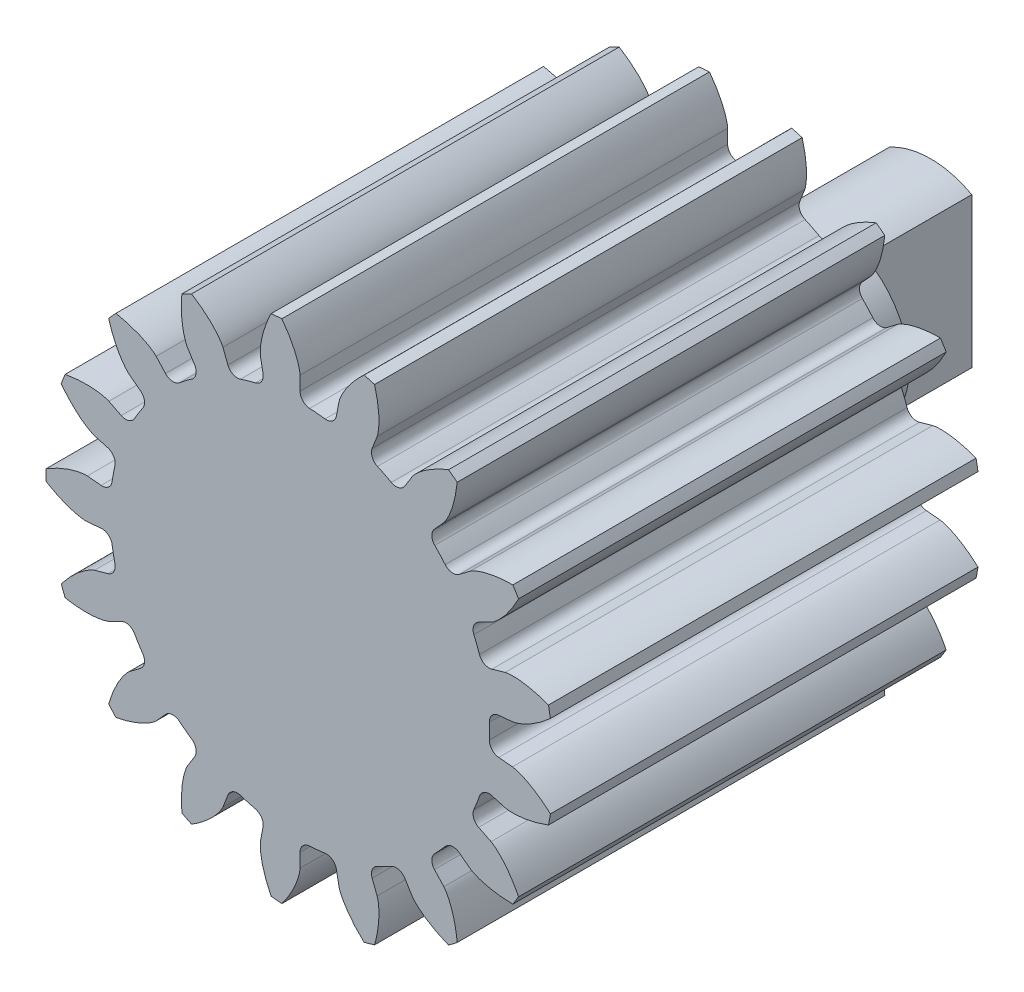
from build123d import *

# Parameters (mm, degrees)
BLANK_SKETCH_R           = 11.875
BLANK_DEPTH              = 20
TOOTH_SPACE_DEPTH        = 27.11572802
TEETH_COUNT              = 17
BORE_DEPTH               = 27.102125703
BORE_DEPTH_BACK          = 27.102125703
BORE_SKETCH_R            = 4
BOSS_EXTRUDE1_START      = -106
SKETCH1_R                = 4
BOSS_EXTRUDE1_DEPTH      = 106
BOSS_EXTRUDE2_DEPTH      = 27.5
BOSS_EXTRUDE2_DEPTH_BACK = 27.5
SKETCH2_R                = 4
CUT_EXTRUDE1_DEPTH       = 5


with BuildPart() as part:
    # Blank Sketch → Blank (new body)
    with BuildSketch(Plane.XY):
        Circle(BLANK_SKETCH_R)
    extrude(amount=BLANK_DEPTH)

    # Tooth Space Sketch → Tooth Space (cut, symmetric)
    with BuildSketch(Plane.XY):
        with BuildLine():
            Line((9.942364801, 0.91340716), (9.298767719, 0.854279759))
            ThreePointArc((9.298767719, 0.854279759), (8.984863997, 0.694192597), (8.867618155, 0.361902274))
            ThreePointArc((8.867618155, 0.361902274), (8.875, 0), (8.867618155, -0.361902274))
            ThreePointArc((8.867618155, -0.361902274), (8.984863997, -0.694192597), (9.298767719, -0.854279759))
            Line((9.298767719, -0.854279759), (9.942364801, -0.91340716))
            add(Edge.make_bspline(
                [(9.942364801, -0.91340716), (9.947707774, -0.913995463), (9.962658326, -0.915943937), (9.990773403, -0.92080477), (10.03637124, -0.930398576), (10.094010888, -0.945054989), (10.167889919, -0.966771469), (10.254035794, -0.995895766), (10.347670082, -1.031581288), (10.448308522, -1.074335805), (10.547535018, -1.120434221), (10.645345427, -1.169591339), (10.74167088, -1.221399901), (10.856958299, -1.28747082), (10.993207383, -1.371281114), (11.149344102, -1.475798759), (11.322581132, -1.601986981), (11.494732709, -1.73857283), (11.660412139, -1.879471881), (11.823262512, -2.029086969), (11.977584919, -2.17897923), (12.132897457, -2.341825663), (12.273746711, -2.495808162), (12.42574568, -2.675962445), (12.546739308, -2.823606943), (12.666700658, -2.982295404), (12.724336253, -3.060430467), (12.753472124, -3.10073762)],
                knots=[0, 0, 0, 0, 0, 0.005376748, 0.015083688, 0.02853182, 0.046610139, 0.064854849, 0.092110525, 0.119476176, 0.146842495, 0.174208854, 0.201574955, 0.228941013, 0.256307345, 0.307035032, 0.361767351, 0.41649966, 0.471231936, 0.525964282, 0.580696615, 0.635428982, 0.690161387, 0.744893688, 0.799626082, 0.854358408, 0.909090915, 0.909090915, 0.909090915, 0.909090915, 0.909090915], degree=4))
            Line((12.753472124, -3.10073762), (12.753472124, 3.10073762))
            add(Edge.make_bspline(
                [(9.942364801, 0.91340716), (9.947707774, 0.913995463), (9.962658326, 0.915943937), (9.990773403, 0.92080477), (10.03637124, 0.930398576), (10.094010888, 0.945054989), (10.167889919, 0.966771469), (10.254035794, 0.995895766), (10.347670082, 1.031581288), (10.448308522, 1.074335805), (10.547535018, 1.120434221), (10.645345427, 1.169591339), (10.74167088, 1.221399901), (10.856958299, 1.28747082), (10.993207383, 1.371281114), (11.149344102, 1.475798759), (11.322581132, 1.601986981), (11.494732709, 1.73857283), (11.660412139, 1.879471881), (11.823262512, 2.029086969), (11.977584919, 2.17897923), (12.132897457, 2.341825663), (12.273746711, 2.495808162), (12.42574568, 2.675962445), (12.546739308, 2.823606943), (12.666700658, 2.982295404), (12.724336253, 3.060430467), (12.753472124, 3.10073762)],
                knots=[0, 0, 0, 0, 0, 0.005376748, 0.015083688, 0.02853182, 0.046610139, 0.064854849, 0.092110525, 0.119476176, 0.146842495, 0.174208854, 0.201574955, 0.228941013, 0.256307345, 0.307035032, 0.361767351, 0.41649966, 0.471231936, 0.525964282, 0.580696615, 0.635428982, 0.690161387, 0.744893688, 0.799626082, 0.854358408, 0.909090915, 0.909090915, 0.909090915, 0.909090915, 0.909090915], degree=4))
        make_face()
    tooth_space = extrude(amount=TOOTH_SPACE_DEPTH, both=True, mode=Mode.SUBTRACT)

    # Teeth: Tooth Space ×17 about axis
    teeth_axis = Axis((0, 0, -95.500007), (0, 0, 1))
    for i in range(1, TEETH_COUNT):
        add(tooth_space.rotate(teeth_axis, i * 360 / TEETH_COUNT), mode=Mode.SUBTRACT)

    # Bore Sketch → Bore (cut, two sides: drawn at the far end of the back side and taken through both)
    with BuildSketch(Plane.XY.offset(-BORE_DEPTH_BACK)):
        Circle(BORE_SKETCH_R)
    extrude(amount=BORE_DEPTH + BORE_DEPTH_BACK, mode=Mode.SUBTRACT)

    # Sketch1 → Boss-Extrude1 (add)
    with BuildSketch(Plane.XY.offset(20).offset(BOSS_EXTRUDE1_START)):
        Circle(SKETCH1_R)
    extrude(amount=BOSS_EXTRUDE1_DEPTH)

    # Sketch2 → Boss-Extrude2 (add, two sides: drawn at the far end of the back side and taken through both)
    with BuildSketch(Plane(origin=(0, 0, 0), x_dir=(0, 0, -1), z_dir=(-0.25761039233351624, 0.9662488736147493, 0)).offset(-BOSS_EXTRUDE2_DEPTH_BACK)):
        with Locations(Location((86, 0, 0), (0, 0, 90))):
            Circle(SKETCH2_R)
    extrude(amount=BOSS_EXTRUDE2_DEPTH + BOSS_EXTRUDE2_DEPTH_BACK)

    # Split1
    split(bisect_by=Plane(origin=(0, 0, -9.5), x_dir=(-1, 0, 0), z_dir=(0, 0, -1)), keep=Keep.BOTTOM)

    # Sketch3 → Cut-Extrude1 (cut)
    with BuildSketch(Plane(origin=(0, 0, -9.5), x_dir=(-1, 0, 0), z_dir=(0, 0, -1))):
        with BuildLine():
            Line((-1.925, 3.506333555), (-1.925, -3.506333555))
            ThreePointArc((-1.925, -3.506333555), (-4, 0), (-1.925, 3.506333555))
        make_face()
        with BuildLine():
            Line((1.925, 3.506333555), (1.925, -3.506333555))
            ThreePointArc((1.925, -3.506333555), (4, 0), (1.925, 3.506333555))
        make_face()
    extrude(amount=-CUT_EXTRUDE1_DEPTH, mode=Mode.SUBTRACT)


solid = part.part
